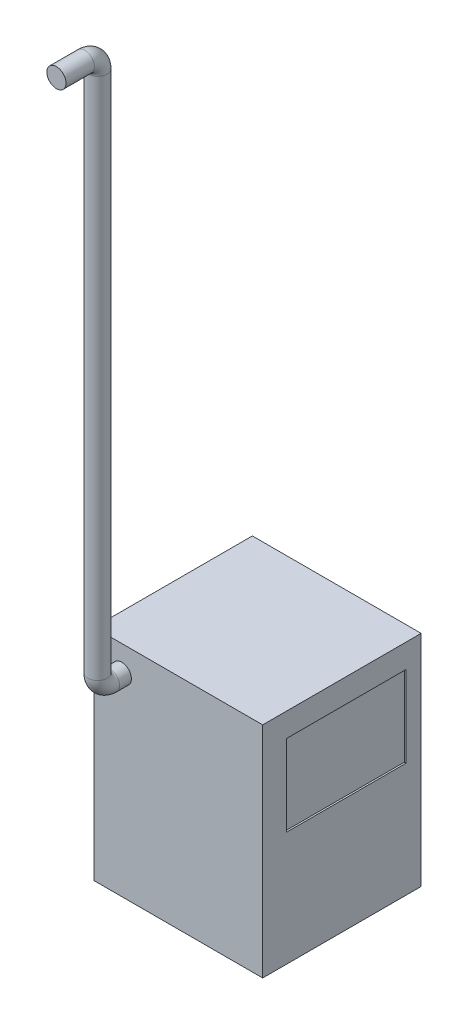
from build123d import *

# Parameters (mm, degrees)
SKETCH1_W           = 187.796310486
SKETCH1_H           = 259.782504146
BOSS_EXTRUDE1_DEPTH = 200
SKETCH2_W           = 141.715117515
SKETCH2_H           = 96.14369286
CUT_EXTRUDE1_DEPTH  = 2
SKETCH3_R           = 11.367887844


with BuildPart() as part:
    # Sketch1 → Boss-Extrude1 (new body)
    with BuildSketch(Plane(origin=(0, 0, 0), x_dir=(0, 0, -1), z_dir=(1, 0, 0))):
        Rectangle(SKETCH1_W, SKETCH1_H)
    extrude(amount=BOSS_EXTRUDE1_DEPTH)

    # Sketch2 → Cut-Extrude1 (cut)
    with BuildSketch(Plane(origin=(200, 0, 0), x_dir=(0, 0, -1), z_dir=(1, 0, 0))):
        with Locations((5.289494402, 53.694775969)):
            Rectangle(SKETCH2_W, SKETCH2_H)
    extrude(amount=-CUT_EXTRUDE1_DEPTH, mode=Mode.SUBTRACT)

    # Sweep3: sweep along a curve in space
    with BuildLine() as sweep3_path:
        Line((33.040603642, 99.336066007, 93.898155243), (33.040603642, 99.336066007, 107.772716538))
        ThreePointArc((33.040603642, 114.336066007, 122.772716538), (33.040603642, 103.729464289, 118.379318255), (33.040603642, 99.336066007, 107.772716538))
        Line((33.040603642, 114.336066007, 122.772716538), (33.040603642, 734.336066007, 122.772716538))
        ThreePointArc((33.040603642, 734.336066007, 122.772716538), (33.040603642, 744.942667725, 127.16611482), (33.040603642, 749.336066007, 137.772716538))
        Line((33.040603642, 749.336066007, 137.772716538), (33.040603642, 749.336066007, 171.355386401))
    # Sketch3 → Sweep3 (sweep)
    with BuildSketch(Plane.XY.offset(93.898155243)):
        with Locations((33.040603642, 99.336066007)):
            Circle(SKETCH3_R)
    sweep(path=sweep3_path.line)


solid = part.part
